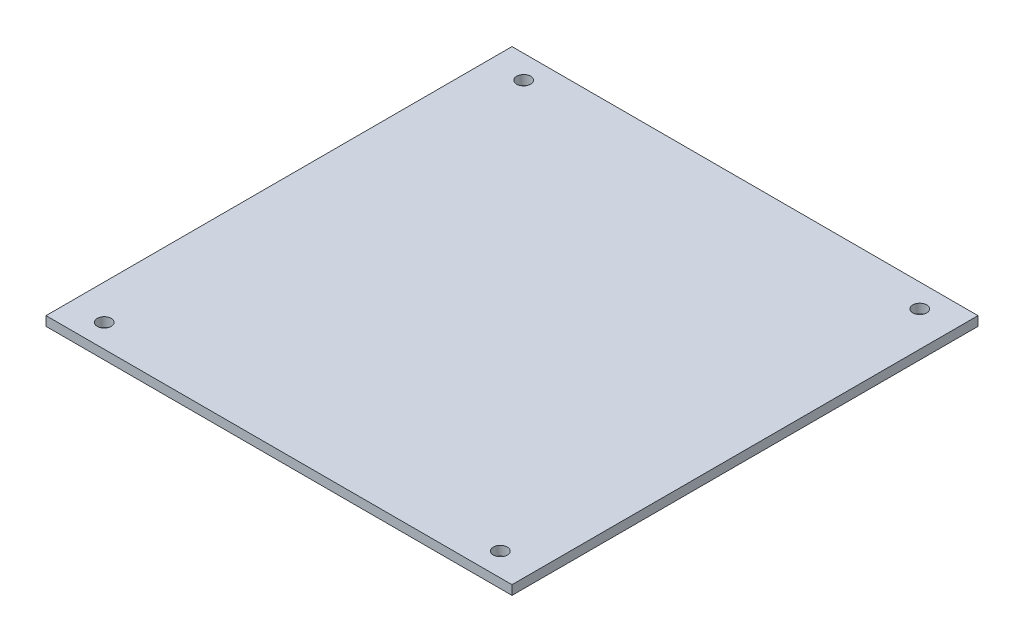
from build123d import *

# Parameters (mm, degrees)
SKETCH1_W      = 100
SKETCH1_H      = 100
EXTRUDE1_DEPTH = 2
SKETCH3_R      = 1.5
EXTRUDE2_DEPTH = 2


with BuildPart() as part:
    # Sketch1 → Extrude1 (new body)
    with BuildSketch(Plane(origin=(0, 0, 0), x_dir=(1, 0, 0), z_dir=(0, 1, 0))):
        Rectangle(SKETCH1_W, SKETCH1_H)
    extrude(amount=EXTRUDE1_DEPTH)

    # Sketch3 → Extrude2 (cut)
    with BuildSketch(Plane(origin=(0, 2, 0), x_dir=(1, 0, 0), z_dir=(0, 1, 0))):
        with Locations(Location((-42.5, 45, 0), (0, 0, 270))):
            Circle(SKETCH3_R)
        with Locations(Location((-42.5, -45, 0), (0, 0, 270))):
            Circle(SKETCH3_R)
        with Locations(Location((42.5, -45, 0), (0, 0, 270))):
            Circle(SKETCH3_R)
        with Locations(Location((42.5, 45, 0), (0, 0, 270))):
            Circle(SKETCH3_R)
    extrude(amount=-EXTRUDE2_DEPTH, mode=Mode.SUBTRACT)


solid = part.part
